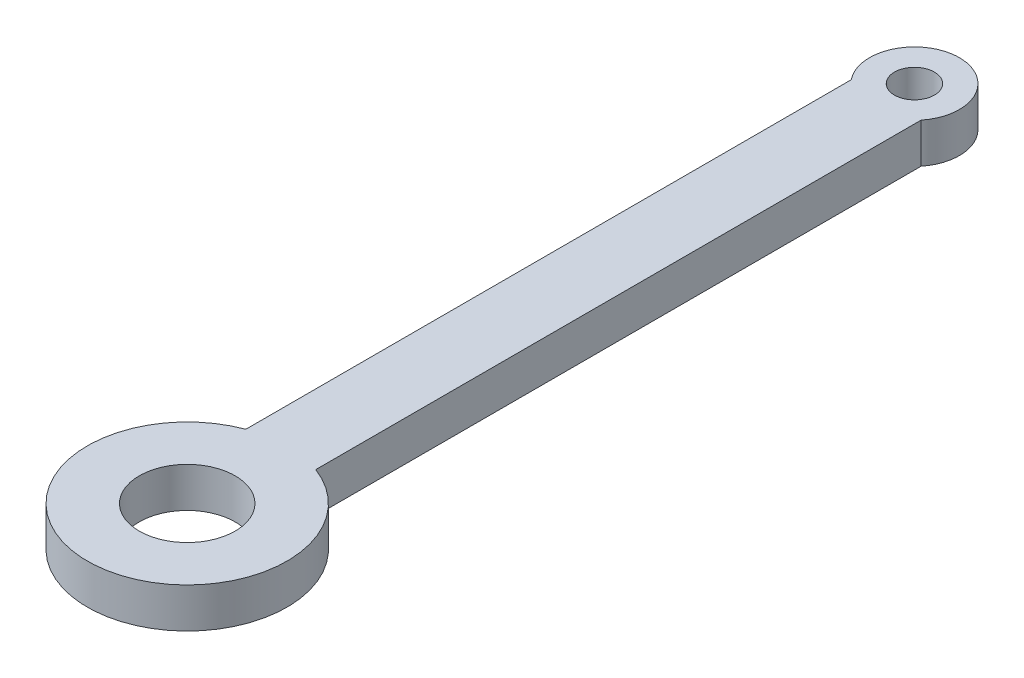
from build123d import *

# Parameters (mm, degrees)
SKETCH1_R           = 2.4
SKETCH1_R_2         = 1
BOSS_EXTRUDE1_DEPTH = 2


with BuildPart() as part:
    # Sketch1 → Boss-Extrude1 (new body)
    with BuildSketch(Plane(origin=(0, 0, 0), x_dir=(1, 0, 0), z_dir=(0, 1, 0))):
        with BuildLine():
            Line((-1.749616263, 4.683891858), (-1.749616263, 34.995311719))
            ThreePointArc((-1.749616263, 34.995311719), (-0.000610522, 38.659999917), (1.750383737, 34.99626142))
            Line((1.750383737, 34.99626142), (1.750383737, 4.683605104))
            ThreePointArc((1.750383737, 4.683605104), (-0.000409648, -4.999999983), (-1.749616263, 4.683891858))
        make_face()
        with Locations(Location((0, 0, 0), (0, 0, 270))):
            Circle(SKETCH1_R, mode=Mode.SUBTRACT)
        with Locations(Location((0, 36.41, 0), (0, 0, 270))):
            Circle(SKETCH1_R_2, mode=Mode.SUBTRACT)
    extrude(amount=BOSS_EXTRUDE1_DEPTH)


solid = part.part
